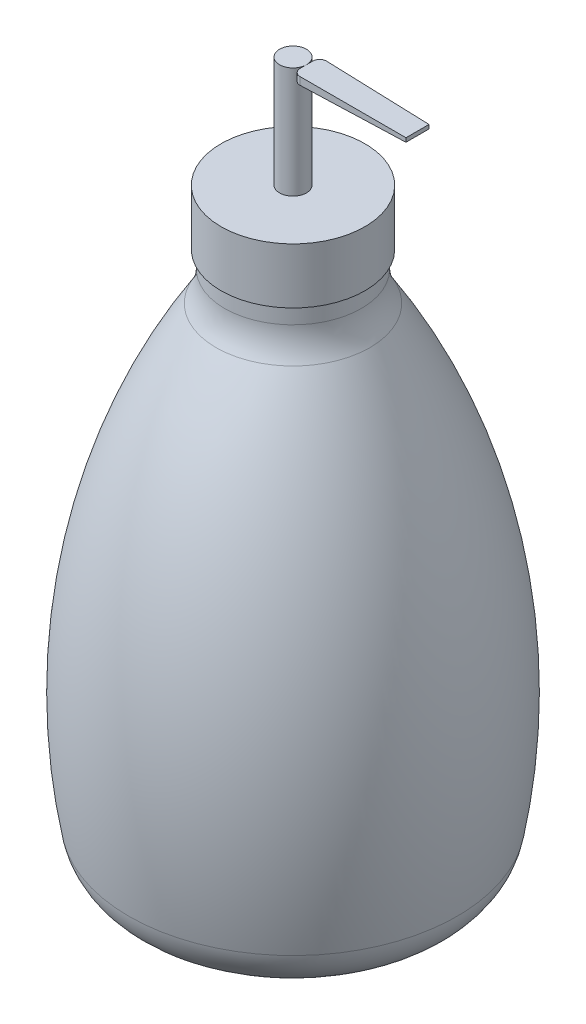
from build123d import *

# Parameters (mm, degrees)
FILLET1_R                = 10.16
BOSS_EXTRUDE1_DEPTH      = 7.62
BOSS_EXTRUDE1_DEPTH_BACK = 2.54
SKETCH2_R                = 13.164943134
SKETCH3_R                = 2.460848641
BOSS_EXTRUDE2_DEPTH      = 20.32
SKETCH4_W                = 4.921697282
SKETCH4_H                = 1.433456433
BOSS_EXTRUDE3_DEPTH      = 20.32
BOSS_EXTRUDE3_TAPER      = 1
FILLET2_R                = 1.27


with BuildPart() as part:
    # Sketch1 → Revolve1 (revolve)
    with BuildSketch(Plane.XY, mode=Mode.PRIVATE) as revolve1_sk:
        with BuildLine():
            Line((0, -43.459441708), (-28.194417077, -43.459441708))
            ThreePointArc((-28.194417077, -43.459441708), (-30.271459741, 4.676745244), (-12.512315271, 49.465353038))
            Line((-12.512315271, 49.465353038), (-12.512315271, 58.140558292))
            Line((-12.512315271, 58.140558292), (0, 58.140558292))
            Line((0, 58.140558292), (0, -43.459441708))
        make_face()
    revolve(revolve1_sk.sketch.rotate(Axis((0, 58.140558292, 0), (0, -1, 0)), 270), axis=Axis((0, 58.140558292, 0), (0, -1, 0)))

    # Fillet1
    fillet1_edges = [part.edges().sort_by_distance(p)[0] for p in [
        (0, -43.459441708, -28.194417077),
        (0, 49.465353038, -12.512315271),
    ]]
    fillet(fillet1_edges, radius=FILLET1_R)


with BuildPart() as body_2:
    # Sketch2 → Boss-Extrude1 (new, two sides: drawn at the far end of the back side and taken through both)
    with BuildSketch(Plane(origin=(0, 58.140558292, 0), x_dir=(1, 0, 0), z_dir=(0, 1, 0)).offset(-BOSS_EXTRUDE1_DEPTH_BACK)):
        with Locations(Location((0, 0, 0), (0, 0, 270))):
            Circle(SKETCH2_R)
    extrude(amount=BOSS_EXTRUDE1_DEPTH + BOSS_EXTRUDE1_DEPTH_BACK)

    # Sketch3 → Boss-Extrude2 (add)
    with BuildSketch(Plane(origin=(0, 65.760558292, 0), x_dir=(1, 0, 0), z_dir=(0, 1, 0))):
        with Locations(Location((0, 0, 0), (0, 0, 270))):
            Circle(SKETCH3_R)
    extrude(amount=BOSS_EXTRUDE2_DEPTH)


with BuildPart() as body_3:
    # Sketch4 → Boss-Extrude3 (new body)
    with BuildSketch(Plane(origin=(2.460848641, 0, 0), x_dir=(0, 0, -1), z_dir=(1, 0, 0))):
        with Locations((0, 85.363830076)):
            Rectangle(SKETCH4_W, SKETCH4_H)
    extrude(amount=BOSS_EXTRUDE3_DEPTH, taper=BOSS_EXTRUDE3_TAPER)

    # Fillet2
    fillet2_edges = [body_3.edges().sort_by_distance(p)[0] for p in [
        (2.460848641, 85.363830075, -2.460848641),
        (2.460848641, 85.363830075, 2.460848641),
    ]]
    fillet(fillet2_edges, radius=FILLET2_R)


solid = Compound([part.part, body_2.part, body_3.part])
